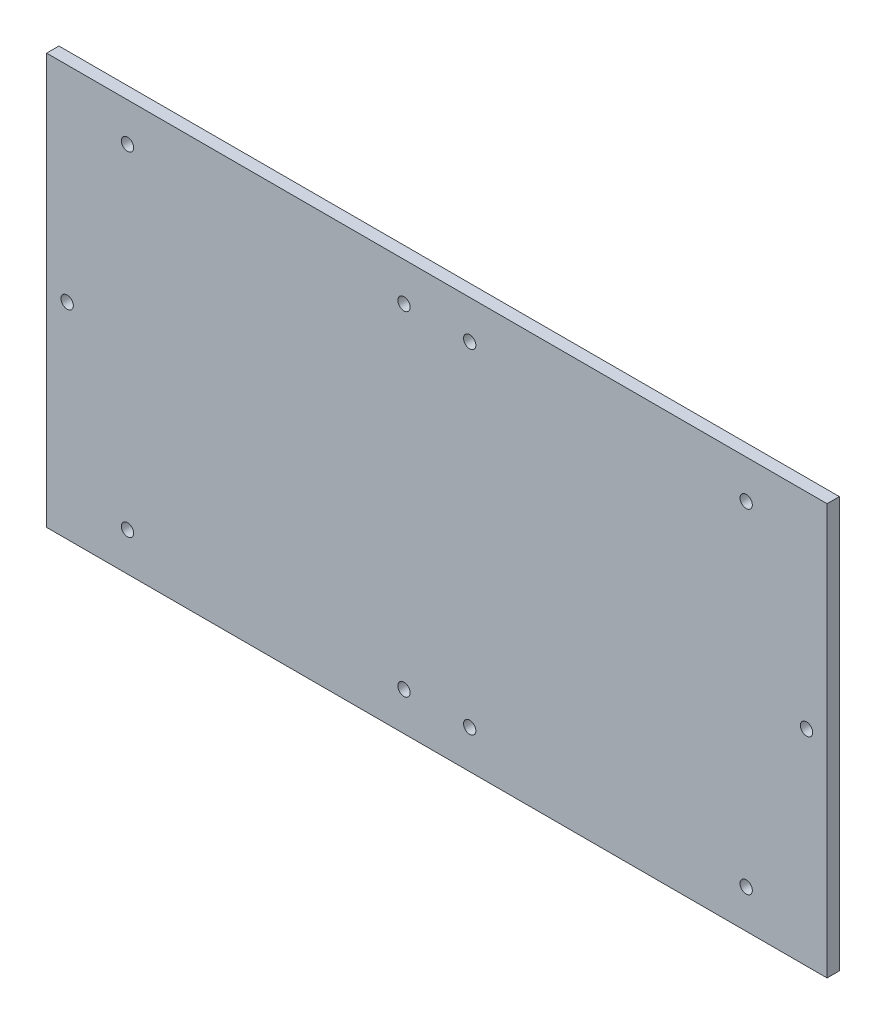
from build123d import *

# Parameters (mm, degrees)
SKETCH1_W           = 190
SKETCH1_H           = 100
BOSS_EXTRUDE1_DEPTH = 3
SKETCH2_R           = 1.5
CUT_EXTRUDE1_DEPTH  = 4


with BuildPart() as part:
    # Sketch1 → Boss-Extrude1 (new body)
    with BuildSketch(Plane.XY):
        Rectangle(SKETCH1_W, SKETCH1_H)
    extrude(amount=BOSS_EXTRUDE1_DEPTH)

    # Sketch2 → Cut-Extrude1 (cut)
    with BuildSketch(Plane.XY.offset(3)):
        with Locations((-75.309963601, 40.64)):
            Circle(SKETCH2_R)
        with Locations((-75.309963601, -40.64)):
            Circle(SKETCH2_R)
        with Locations((-7.999963601, 40.64)):
            Circle(SKETCH2_R)
        with Locations((-7.999963601, -40.64)):
            Circle(SKETCH2_R)
        with Locations((8, 40.64)):
            Circle(SKETCH2_R)
        with Locations((75.31, 40.64)):
            Circle(SKETCH2_R)
        with Locations((75.31, -40.64)):
            Circle(SKETCH2_R)
        with Locations((8, -40.64)):
            Circle(SKETCH2_R)
        with Locations((-90, 0)):
            Circle(SKETCH2_R)
        with Locations((90, 0)):
            Circle(SKETCH2_R)
    extrude(amount=-CUT_EXTRUDE1_DEPTH, mode=Mode.SUBTRACT)


solid = part.part
